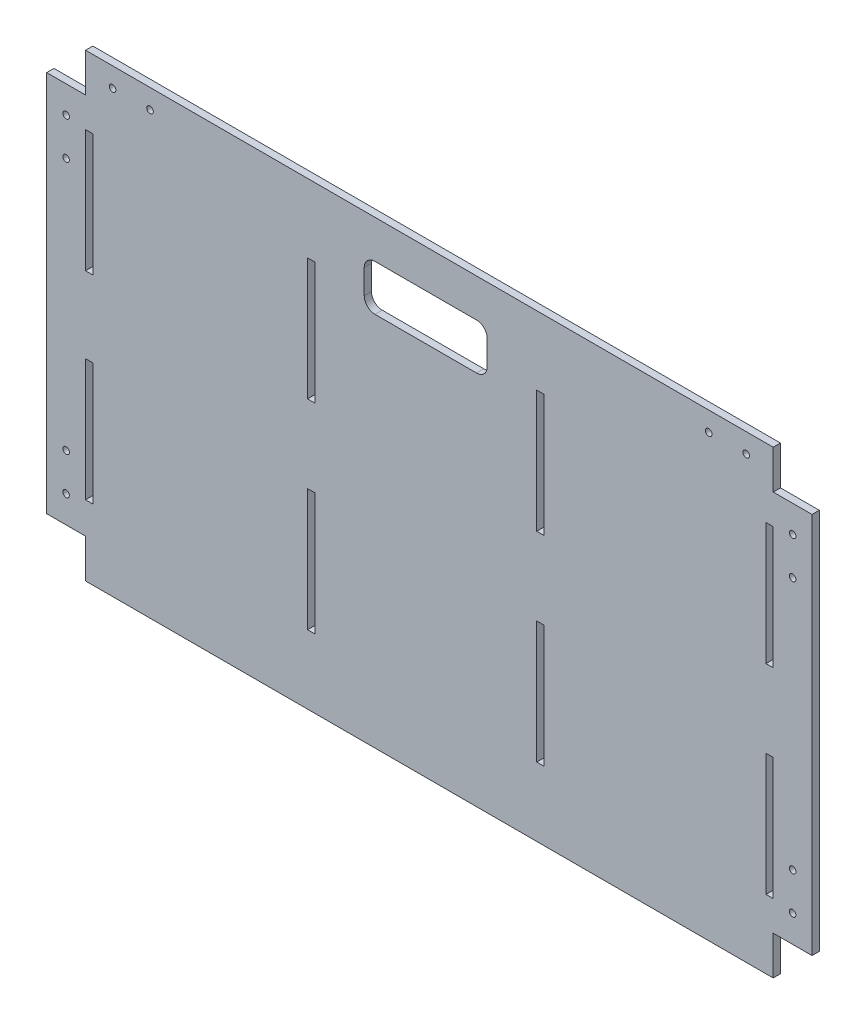
from build123d import *

# Parameters (mm, degrees)
SKETCH_1_W          = 500.8
SKETCH_1_H          = 300.8
EXTRUDE_1_DEPTH     = 4.75
SKETCH_2_W          = 25.4
SKETCH_2_H          = 25.4
SKETCH_2_W_2        = 4.75
SKETCH_2_H_2        = 80
CUT_EXTRUDE_1_DEPTH = 10
SKETCH_3_R          = 2.150000004
SKETCH_3_R_2        = 2.15
CUT_EXTRUDE_2_DEPTH = 5
SKETCH_4_W          = 80.5
SKETCH_4_H          = 30
CUT_EXTRUDE_3_DEPTH = 4.75
FILLET_1_R          = 7


with BuildPart() as part:
    # 草圖1 → 填料-伸長1 (new body)
    with BuildSketch(Plane.XY):
        Rectangle(SKETCH_1_W, SKETCH_1_H)
    extrude(amount=EXTRUDE_1_DEPTH)

    # 草圖2 → 除料-伸長1 (cut)
    with BuildSketch(Plane(origin=(0, 0, 0), x_dir=(-1, 0, 0), z_dir=(0, 0, -1))):
        with Locations((-237.7, 137.7)):
            Rectangle(SKETCH_2_W, SKETCH_2_H)
        with Locations((-237.7, -137.7)):
            Rectangle(SKETCH_2_W, SKETCH_2_H)
        with Locations((237.7, 137.7)):
            Rectangle(SKETCH_2_W, SKETCH_2_H)
        with Locations((237.7, -137.7)):
            Rectangle(SKETCH_2_W, SKETCH_2_H)
        with Locations((-222.625, 65.4)):
            Rectangle(SKETCH_2_W_2, SKETCH_2_H_2)
        with Locations((-222.625, -65.4)):
            Rectangle(SKETCH_2_W_2, SKETCH_2_H_2)
        with Locations((222.625, 65.4)):
            Rectangle(SKETCH_2_W_2, SKETCH_2_H_2)
        with Locations((222.625, -64.4)):
            Rectangle(SKETCH_2_W_2, SKETCH_2_H_2)
        with Locations((-72.625, 65.4)):
            Rectangle(SKETCH_2_W_2, SKETCH_2_H_2)
        with Locations((77.375, 65.4)):
            Rectangle(SKETCH_2_W_2, SKETCH_2_H_2)
        with Locations((77.375, -65.4)):
            Rectangle(SKETCH_2_W_2, SKETCH_2_H_2)
        with Locations((-72.625, -65.4)):
            Rectangle(SKETCH_2_W_2, SKETCH_2_H_2)
    extrude(amount=-CUT_EXTRUDE_1_DEPTH, mode=Mode.SUBTRACT)

    # 草圖3 → 除料-伸長2 (cut)
    with BuildSketch(Plane.XY.offset(4.75)):
        with Locations((-237.7, 107.300000013)):
            Circle(SKETCH_3_R)
        with Locations((-237.7, 82.800000013)):
            Circle(SKETCH_3_R)
        with Locations((-207.3, 137.700000006)):
            Circle(SKETCH_3_R_2)
        with Locations((-182.8, 137.700000006)):
            Circle(SKETCH_3_R_2)
        with Locations((-237.7, -82.800000001)):
            Circle(SKETCH_3_R_2)
        with Locations((-237.7, -107.300000001)):
            Circle(SKETCH_3_R_2)
        with Locations((237.7, -107.300000007)):
            Circle(SKETCH_3_R)
        with Locations((237.7, -82.800000007)):
            Circle(SKETCH_3_R)
        with Locations((237.7, 107.300000006)):
            Circle(SKETCH_3_R_2)
        with Locations((237.7, 82.800000006)):
            Circle(SKETCH_3_R_2)
        with Locations((182.8, 137.700000006)):
            Circle(SKETCH_3_R_2)
        with Locations((207.3, 137.700000006)):
            Circle(SKETCH_3_R_2)
    extrude(amount=-CUT_EXTRUDE_2_DEPTH, mode=Mode.SUBTRACT)

    # 草圖4 → 除料-伸長3 (cut)
    with BuildSketch(Plane.XY.offset(4.75)):
        with Locations((-2.375, 110.4)):
            Rectangle(SKETCH_4_W, SKETCH_4_H)
    extrude(amount=-CUT_EXTRUDE_3_DEPTH, mode=Mode.SUBTRACT)

    # 圓角1
    fillet_1_edges = [part.edges().sort_by_distance(p)[0] for p in [
        (37.875, 125.4, 2.375),
        (37.875, 95.4, 2.375),
        (-42.625, 95.4, 2.375),
        (-42.625, 125.4, 2.375),
    ]]
    fillet(fillet_1_edges, radius=FILLET_1_R)


solid = part.part
